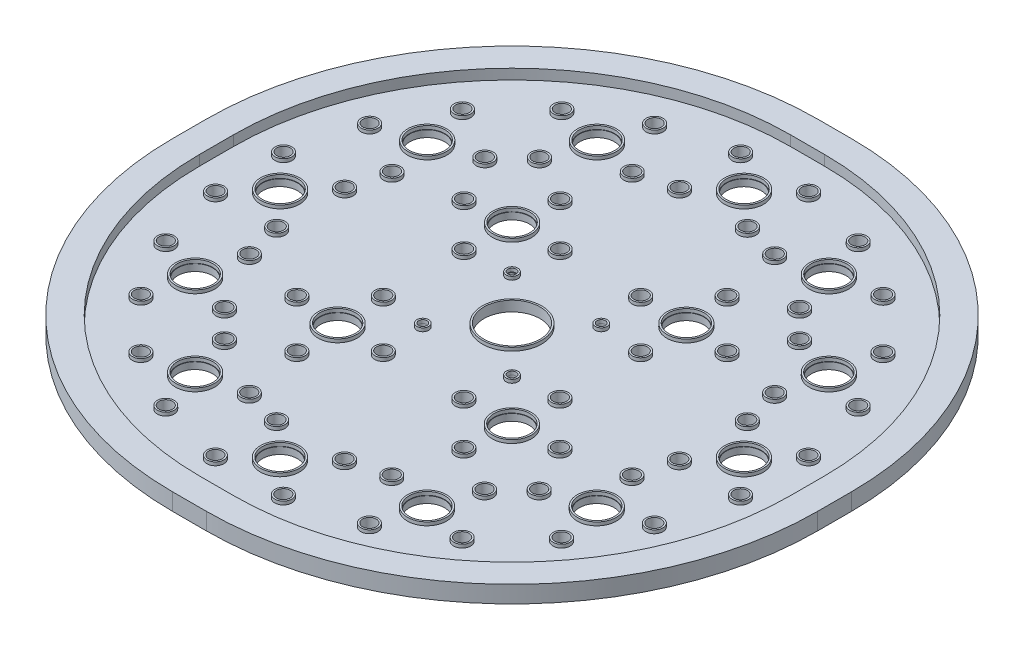
from build123d import *

# Parameters (mm, degrees)
SKETCH1_R           = 5.125
SKETCH1_R_2         = 2
SKETCH1_R_3         = 1.25
SKETCH1_R_4         = 8.25
BOSS_EXTRUDE2_DEPTH = 2
BOSS_EXTRUDE3_DEPTH = 3
SKETCH3_R           = 5.75
SKETCH3_R_2         = 5.25
SKETCH3_R_3         = 2.5
SKETCH3_R_4         = 2
SKETCH3_R_5         = 8.75
SKETCH3_R_6         = 8.25
SKETCH3_R_7         = 1.735
SKETCH3_R_8         = 1.235120991
BOSS_EXTRUDE7_DEPTH = 1


with BuildPart() as part:
    # Sketch1 → Boss-Extrude2 (new body)
    with BuildSketch(Plane(origin=(0, 0, 0), x_dir=(1, 0, 0), z_dir=(0, 1, 0))):
        with BuildLine():
            Line((-95, -5), (-95, 5))
            ThreePointArc((-95, 5), (-68.639610307, 68.639610307), (-5, 95))
            Line((-5, 95), (5, 95))
            ThreePointArc((5, 95), (68.639610307, 68.639610307), (95, 5))
            Line((95, 5), (95, -5))
            ThreePointArc((95, -5), (68.639610307, -68.639610307), (5, -95))
            Line((5, -95), (-5, -95))
            ThreePointArc((-5, -95), (-68.639610307, -68.639610307), (-95, -5))
        make_face()
        with Locations(Location((-68.3, 0.025, 0), (0, 0, 270))):
            Circle(SKETCH1_R, mode=Mode.SUBTRACT)
        with Locations(Location((-59.3, 10.028970285, 0), (0, 0, 270))):
            Circle(SKETCH1_R_2, mode=Mode.SUBTRACT)
        with Locations(Location((-59.3, -9.971029715, 0), (0, 0, 270))):
            Circle(SKETCH1_R_2, mode=Mode.SUBTRACT)
        with Locations(Location((-77.3, -9.971029715, 0), (0, 0, 270))):
            Circle(SKETCH1_R_2, mode=Mode.SUBTRACT)
        with Locations(Location((-77.3, 10.028970285, 0), (0, 0, 270))):
            Circle(SKETCH1_R_2, mode=Mode.SUBTRACT)
        with Locations(Location((-61.92927857, 47.33534304, 0), (0, 0, 270))):
            Circle(SKETCH1_R_2, mode=Mode.SUBTRACT)
        with Locations(Location((-59.137035078, 34.171650635, 0), (0, 0, 270))):
            Circle(SKETCH1_R, mode=Mode.SUBTRACT)
        with Locations(Location((-71.92927857, 30.014834965, 0), (0, 0, 270))):
            Circle(SKETCH1_R_2, mode=Mode.SUBTRACT)
        with Locations(Location((-56.340821302, 21.014834965, 0), (0, 0, 270))):
            Circle(SKETCH1_R_2, mode=Mode.SUBTRACT)
        with Locations(Location((-46.340821302, 38.33534304, 0), (0, 0, 270))):
            Circle(SKETCH1_R_2, mode=Mode.SUBTRACT)
        with Locations(Location((-29.96465696, 71.958248855, 0), (0, 0, 270))):
            Circle(SKETCH1_R_2, mode=Mode.SUBTRACT)
        with Locations(Location((-34.128349365, 59.162035078, 0), (0, 0, 270))):
            Circle(SKETCH1_R, mode=Mode.SUBTRACT)
        with Locations(Location((-47.285165035, 61.958248855, 0), (0, 0, 270))):
            Circle(SKETCH1_R_2, mode=Mode.SUBTRACT)
        with Locations(Location((-38.285165035, 46.369791587, 0), (0, 0, 270))):
            Circle(SKETCH1_R_2, mode=Mode.SUBTRACT)
        with Locations(Location((-20.96465696, 56.369791587, 0), (0, 0, 270))):
            Circle(SKETCH1_R_2, mode=Mode.SUBTRACT)
        with Locations(Location((10.028970285, 77.3, 0), (0, 0, 270))):
            Circle(SKETCH1_R_2, mode=Mode.SUBTRACT)
        with Locations(Location((0.025, 68.3, 0), (0, 0, 270))):
            Circle(SKETCH1_R, mode=Mode.SUBTRACT)
        with Locations(Location((-9.971029715, 77.3, 0), (0, 0, 270))):
            Circle(SKETCH1_R_2, mode=Mode.SUBTRACT)
        with Locations(Location((-9.971029715, 59.3, 0), (0, 0, 270))):
            Circle(SKETCH1_R_2, mode=Mode.SUBTRACT)
        with Locations(Location((10.028970285, 59.3, 0), (0, 0, 270))):
            Circle(SKETCH1_R_2, mode=Mode.SUBTRACT)
        with Locations(Location((47.33534304, 61.92927857, 0), (0, 0, 270))):
            Circle(SKETCH1_R_2, mode=Mode.SUBTRACT)
        with Locations(Location((34.171650635, 59.137035078, 0), (0, 0, 270))):
            Circle(SKETCH1_R, mode=Mode.SUBTRACT)
        with Locations(Location((30.014834965, 71.92927857, 0), (0, 0, 270))):
            Circle(SKETCH1_R_2, mode=Mode.SUBTRACT)
        with Locations(Location((21.014834965, 56.340821302, 0), (0, 0, 270))):
            Circle(SKETCH1_R_2, mode=Mode.SUBTRACT)
        with Locations(Location((38.33534304, 46.340821302, 0), (0, 0, 270))):
            Circle(SKETCH1_R_2, mode=Mode.SUBTRACT)
        with Locations(Location((71.958248855, 29.96465696, 0), (0, 0, 270))):
            Circle(SKETCH1_R_2, mode=Mode.SUBTRACT)
        with Locations(Location((59.162035078, 34.128349365, 0), (0, 0, 270))):
            Circle(SKETCH1_R, mode=Mode.SUBTRACT)
        with Locations(Location((61.958248855, 47.285165035, 0), (0, 0, 270))):
            Circle(SKETCH1_R_2, mode=Mode.SUBTRACT)
        with Locations(Location((46.369791587, 38.285165035, 0), (0, 0, 270))):
            Circle(SKETCH1_R_2, mode=Mode.SUBTRACT)
        with Locations(Location((56.369791587, 20.96465696, 0), (0, 0, 270))):
            Circle(SKETCH1_R_2, mode=Mode.SUBTRACT)
        with Locations(Location((77.3, -10.028970285, 0), (0, 0, 270))):
            Circle(SKETCH1_R_2, mode=Mode.SUBTRACT)
        with Locations(Location((68.3, -0.025, 0), (0, 0, 270))):
            Circle(SKETCH1_R, mode=Mode.SUBTRACT)
        with Locations(Location((77.3, 9.971029715, 0), (0, 0, 270))):
            Circle(SKETCH1_R_2, mode=Mode.SUBTRACT)
        with Locations(Location((59.3, 9.971029715, 0), (0, 0, 270))):
            Circle(SKETCH1_R_2, mode=Mode.SUBTRACT)
        with Locations(Location((59.3, -10.028970285, 0), (0, 0, 270))):
            Circle(SKETCH1_R_2, mode=Mode.SUBTRACT)
        with Locations(Location((61.92927857, -47.33534304, 0), (0, 0, 270))):
            Circle(SKETCH1_R_2, mode=Mode.SUBTRACT)
        with Locations(Location((59.137035078, -34.171650635, 0), (0, 0, 270))):
            Circle(SKETCH1_R, mode=Mode.SUBTRACT)
        with Locations(Location((71.92927857, -30.014834965, 0), (0, 0, 270))):
            Circle(SKETCH1_R_2, mode=Mode.SUBTRACT)
        with Locations(Location((56.340821302, -21.014834965, 0), (0, 0, 270))):
            Circle(SKETCH1_R_2, mode=Mode.SUBTRACT)
        with Locations(Location((46.340821302, -38.33534304, 0), (0, 0, 270))):
            Circle(SKETCH1_R_2, mode=Mode.SUBTRACT)
        with Locations(Location((29.96465696, -71.958248855, 0), (0, 0, 270))):
            Circle(SKETCH1_R_2, mode=Mode.SUBTRACT)
        with Locations(Location((34.128349365, -59.162035078, 0), (0, 0, 270))):
            Circle(SKETCH1_R, mode=Mode.SUBTRACT)
        with Locations(Location((47.285165035, -61.958248855, 0), (0, 0, 270))):
            Circle(SKETCH1_R_2, mode=Mode.SUBTRACT)
        with Locations(Location((38.285165035, -46.369791587, 0), (0, 0, 270))):
            Circle(SKETCH1_R_2, mode=Mode.SUBTRACT)
        with Locations(Location((20.96465696, -56.369791587, 0), (0, 0, 270))):
            Circle(SKETCH1_R_2, mode=Mode.SUBTRACT)
        with Locations(Location((-10.028970285, -77.3, 0), (0, 0, 270))):
            Circle(SKETCH1_R_2, mode=Mode.SUBTRACT)
        with Locations(Location((-0.025, -68.3, 0), (0, 0, 270))):
            Circle(SKETCH1_R, mode=Mode.SUBTRACT)
        with Locations(Location((9.971029715, -77.3, 0), (0, 0, 270))):
            Circle(SKETCH1_R_2, mode=Mode.SUBTRACT)
        with Locations(Location((9.971029715, -59.3, 0), (0, 0, 270))):
            Circle(SKETCH1_R_2, mode=Mode.SUBTRACT)
        with Locations(Location((-10.028970285, -59.3, 0), (0, 0, 270))):
            Circle(SKETCH1_R_2, mode=Mode.SUBTRACT)
        with Locations(Location((-47.33534304, -61.92927857, 0), (0, 0, 270))):
            Circle(SKETCH1_R_2, mode=Mode.SUBTRACT)
        with Locations(Location((-34.171650635, -59.137035078, 0), (0, 0, 270))):
            Circle(SKETCH1_R, mode=Mode.SUBTRACT)
        with Locations(Location((-30.014834965, -71.92927857, 0), (0, 0, 270))):
            Circle(SKETCH1_R_2, mode=Mode.SUBTRACT)
        with Locations(Location((-21.014834965, -56.340821302, 0), (0, 0, 270))):
            Circle(SKETCH1_R_2, mode=Mode.SUBTRACT)
        with Locations(Location((-38.33534304, -46.340821302, 0), (0, 0, 270))):
            Circle(SKETCH1_R_2, mode=Mode.SUBTRACT)
        with Locations(Location((-71.958248855, -29.96465696, 0), (0, 0, 270))):
            Circle(SKETCH1_R_2, mode=Mode.SUBTRACT)
        with Locations(Location((-59.162035078, -34.128349365, 0), (0, 0, 270))):
            Circle(SKETCH1_R, mode=Mode.SUBTRACT)
        with Locations(Location((-61.958248855, -47.285165035, 0), (0, 0, 270))):
            Circle(SKETCH1_R_2, mode=Mode.SUBTRACT)
        with Locations(Location((-46.369791587, -38.285165035, 0), (0, 0, 270))):
            Circle(SKETCH1_R_2, mode=Mode.SUBTRACT)
        with Locations(Location((-56.369791587, -20.96465696, 0), (0, 0, 270))):
            Circle(SKETCH1_R_2, mode=Mode.SUBTRACT)
        with Locations(Location((-13.135, -13.135, 0), (0, 0, 270))):
            Circle(SKETCH1_R_3, mode=Mode.SUBTRACT)
        with Locations(Location((13.135, -13.135, 0), (0, 0, 270))):
            Circle(SKETCH1_R_3, mode=Mode.SUBTRACT)
        with Locations(Location((13.135, 13.135, 0), (0, 0, 270))):
            Circle(SKETCH1_R_3, mode=Mode.SUBTRACT)
        with Locations(Location((-13.135, 12.8, 0), (0, 0, 270))):
            Circle(SKETCH1_R_3, mode=Mode.SUBTRACT)
        with Locations(Location((-11.858908839, 26.042014632, 0), (0, 0, 270))):
            Circle(SKETCH1_R_2, mode=Mode.SUBTRACT)
        with Locations(Location((-24.5868309, 38.769936694, 0), (0, 0, 270))):
            Circle(SKETCH1_R_2, mode=Mode.SUBTRACT)
        with Locations(Location((-38.728966524, 24.62780107, 0), (0, 0, 270))):
            Circle(SKETCH1_R_2, mode=Mode.SUBTRACT)
        with Locations(Location((-26.001044463, 11.899879009, 0), (0, 0, 270))):
            Circle(SKETCH1_R_2, mode=Mode.SUBTRACT)
        with Locations(Location((26.042014632, 11.858908839, 0), (0, 0, 270))):
            Circle(SKETCH1_R_2, mode=Mode.SUBTRACT)
        with Locations(Location((38.769936694, 24.5868309, 0), (0, 0, 270))):
            Circle(SKETCH1_R_2, mode=Mode.SUBTRACT)
        with Locations(Location((24.62780107, 38.728966524, 0), (0, 0, 270))):
            Circle(SKETCH1_R_2, mode=Mode.SUBTRACT)
        with Locations(Location((11.899879009, 26.001044463, 0), (0, 0, 270))):
            Circle(SKETCH1_R_2, mode=Mode.SUBTRACT)
        with Locations(Location((11.858908839, -26.042014632, 0), (0, 0, 270))):
            Circle(SKETCH1_R_2, mode=Mode.SUBTRACT)
        with Locations(Location((24.5868309, -38.769936694, 0), (0, 0, 270))):
            Circle(SKETCH1_R_2, mode=Mode.SUBTRACT)
        with Locations(Location((38.728966524, -24.62780107, 0), (0, 0, 270))):
            Circle(SKETCH1_R_2, mode=Mode.SUBTRACT)
        with Locations(Location((26.001044463, -11.899879009, 0), (0, 0, 270))):
            Circle(SKETCH1_R_2, mode=Mode.SUBTRACT)
        with Locations(Location((-26.042014632, -11.858908839, 0), (0, 0, 270))):
            Circle(SKETCH1_R_2, mode=Mode.SUBTRACT)
        with Locations(Location((-38.769936694, -24.5868309, 0), (0, 0, 270))):
            Circle(SKETCH1_R_2, mode=Mode.SUBTRACT)
        with Locations(Location((-24.62780107, -38.728966524, 0), (0, 0, 270))):
            Circle(SKETCH1_R_2, mode=Mode.SUBTRACT)
        with Locations(Location((-11.899879009, -26.001044463, 0), (0, 0, 270))):
            Circle(SKETCH1_R_2, mode=Mode.SUBTRACT)
        with Locations(Location((0, 0, 0), (0, 0, 270))):
            Circle(SKETCH1_R_4, mode=Mode.SUBTRACT)
        with Locations(Location((-25.685653827, -25.650298488, 0), (0, 0, 270))):
            Circle(SKETCH1_R, mode=Mode.SUBTRACT)
        with Locations(Location((-25.650298488, 25.685653827, 0), (0, 0, 270))):
            Circle(SKETCH1_R, mode=Mode.SUBTRACT)
        with Locations(Location((25.685653827, 25.650298488, 0), (0, 0, 270))):
            Circle(SKETCH1_R, mode=Mode.SUBTRACT)
        with Locations(Location((25.650298488, -25.685653827, 0), (0, 0, 270))):
            Circle(SKETCH1_R, mode=Mode.SUBTRACT)
    extrude(amount=BOSS_EXTRUDE2_DEPTH)

    # Sketch2 → Boss-Extrude3 (add)
    with BuildSketch(Plane(origin=(0, 2, 0), x_dir=(1, 0, 0), z_dir=(0, 1, 0))):
        with BuildLine():
            Line((-5, -95), (5, -95))
            ThreePointArc((5, -95), (68.639610307, -68.639610307), (95, -5))
            Line((95, -5), (95, 5))
            ThreePointArc((95, 5), (68.639610307, 68.639610307), (5, 95))
            Line((5, 95), (-5, 95))
            ThreePointArc((-5, 95), (-68.639610307, 68.639610307), (-95, 5))
            Line((-95, 5), (-95, -5))
            ThreePointArc((-95, -5), (-68.639610307, -68.639610307), (-5, -95))
        make_face()
        with BuildLine():
            ThreePointArc((-87, -5), (-62.982756057, -62.982756057), (-5, -87))
            Line((-5, -87), (5, -87))
            ThreePointArc((5, -87), (62.982756057, -62.982756057), (87, -5))
            Line((87, -5), (87, 5))
            ThreePointArc((87, 5), (62.982756057, 62.982756057), (5, 87))
            Line((5, 87), (-5, 87))
            ThreePointArc((-5, 87), (-62.982756057, 62.982756057), (-87, 5))
            Line((-87, 5), (-87, -5))
        make_face(mode=Mode.SUBTRACT)
    extrude(amount=BOSS_EXTRUDE3_DEPTH)

    # Sketch3 → Boss-Extrude7 (add)
    # profile 1 of 85: a face of its own
    with BuildSketch(Plane(origin=(0, 2, 0), x_dir=(1, 0, 0), z_dir=(0, 1, 0))):
        with Locations(Location((-59.162035078, -34.128349365, 0), (0, 0, 90))):
            Circle(SKETCH3_R)
        with Locations(Location((-59.162035078, -34.128349365, 0), (0, 0, 270))):
            Circle(SKETCH3_R_2, mode=Mode.SUBTRACT)
    # profile 2 of 85: a face of its own
    with BuildSketch(Plane(origin=(0, 2, 0), x_dir=(1, 0, 0), z_dir=(0, 1, 0))):
        with Locations(Location((-68.3, 0.025, 0), (0, 0, 90))):
            Circle(SKETCH3_R)
        with Locations(Location((-68.3, 0.025, 0), (0, 0, 270))):
            Circle(SKETCH3_R_2, mode=Mode.SUBTRACT)
    # profile 3 of 85: a face of its own
    with BuildSketch(Plane(origin=(0, 2, 0), x_dir=(1, 0, 0), z_dir=(0, 1, 0))):
        with Locations(Location((-59.137035078, 34.171650635, 0), (0, 0, 90))):
            Circle(SKETCH3_R)
        with Locations(Location((-59.137035078, 34.171650635, 0), (0, 0, 270))):
            Circle(SKETCH3_R_2, mode=Mode.SUBTRACT)
    # profile 4 of 85: a face of its own
    with BuildSketch(Plane(origin=(0, 2, 0), x_dir=(1, 0, 0), z_dir=(0, 1, 0))):
        with Locations(Location((-34.128349365, 59.162035078, 0), (0, 0, 90))):
            Circle(SKETCH3_R)
        with Locations(Location((-34.128349365, 59.162035078, 0), (0, 0, 270))):
            Circle(SKETCH3_R_2, mode=Mode.SUBTRACT)
    # profile 5 of 85: a face of its own
    with BuildSketch(Plane(origin=(0, 2, 0), x_dir=(1, 0, 0), z_dir=(0, 1, 0))):
        with Locations(Location((0.025, 68.3, 0), (0, 0, 90))):
            Circle(SKETCH3_R)
        with Locations(Location((0.025, 68.3, 0), (0, 0, 270))):
            Circle(SKETCH3_R_2, mode=Mode.SUBTRACT)
    # profile 6 of 85: a face of its own
    with BuildSketch(Plane(origin=(0, 2, 0), x_dir=(1, 0, 0), z_dir=(0, 1, 0))):
        with Locations(Location((34.171650635, 59.137035078, 0), (0, 0, 90))):
            Circle(SKETCH3_R)
        with Locations(Location((34.171650635, 59.137035078, 0), (0, 0, 270))):
            Circle(SKETCH3_R_2, mode=Mode.SUBTRACT)
    # profile 7 of 85: a face of its own
    with BuildSketch(Plane(origin=(0, 2, 0), x_dir=(1, 0, 0), z_dir=(0, 1, 0))):
        with Locations(Location((59.162035078, 34.128349365, 0), (0, 0, 90))):
            Circle(SKETCH3_R)
        with Locations(Location((59.162035078, 34.128349365, 0), (0, 0, 270))):
            Circle(SKETCH3_R_2, mode=Mode.SUBTRACT)
    # profile 8 of 85: a face of its own
    with BuildSketch(Plane(origin=(0, 2, 0), x_dir=(1, 0, 0), z_dir=(0, 1, 0))):
        with Locations(Location((68.3, -0.025, 0), (0, 0, 90))):
            Circle(SKETCH3_R)
        with Locations(Location((68.3, -0.025, 0), (0, 0, 270))):
            Circle(SKETCH3_R_2, mode=Mode.SUBTRACT)
    # profile 9 of 85: a face of its own
    with BuildSketch(Plane(origin=(0, 2, 0), x_dir=(1, 0, 0), z_dir=(0, 1, 0))):
        with Locations(Location((59.137035078, -34.171650635, 0), (0, 0, 90))):
            Circle(SKETCH3_R)
        with Locations(Location((59.137035078, -34.171650635, 0), (0, 0, 270))):
            Circle(SKETCH3_R_2, mode=Mode.SUBTRACT)
    # profile 10 of 85: a face of its own
    with BuildSketch(Plane(origin=(0, 2, 0), x_dir=(1, 0, 0), z_dir=(0, 1, 0))):
        with Locations(Location((34.128349365, -59.162035078, 0), (0, 0, 90))):
            Circle(SKETCH3_R)
        with Locations(Location((34.128349365, -59.162035078, 0), (0, 0, 270))):
            Circle(SKETCH3_R_2, mode=Mode.SUBTRACT)
    # profile 11 of 85: a face of its own
    with BuildSketch(Plane(origin=(0, 2, 0), x_dir=(1, 0, 0), z_dir=(0, 1, 0))):
        with Locations(Location((-0.025, -68.3, 0), (0, 0, 90))):
            Circle(SKETCH3_R)
        with Locations(Location((-0.025, -68.3, 0), (0, 0, 270))):
            Circle(SKETCH3_R_2, mode=Mode.SUBTRACT)
    # profile 12 of 85: a face of its own
    with BuildSketch(Plane(origin=(0, 2, 0), x_dir=(1, 0, 0), z_dir=(0, 1, 0))):
        with Locations(Location((-34.171650635, -59.137035078, 0), (0, 0, 90))):
            Circle(SKETCH3_R)
        with Locations(Location((-34.171650635, -59.137035078, 0), (0, 0, 270))):
            Circle(SKETCH3_R_2, mode=Mode.SUBTRACT)
    # profile 13 of 85: a face of its own
    with BuildSketch(Plane(origin=(0, 2, 0), x_dir=(1, 0, 0), z_dir=(0, 1, 0))):
        with Locations(Location((-25.685653827, -25.650298488, 0), (0, 0, 90))):
            Circle(SKETCH3_R)
        with Locations(Location((-25.685653827, -25.650298488, 0), (0, 0, 270))):
            Circle(SKETCH3_R_2, mode=Mode.SUBTRACT)
    # profile 14 of 85: a face of its own
    with BuildSketch(Plane(origin=(0, 2, 0), x_dir=(1, 0, 0), z_dir=(0, 1, 0))):
        with Locations(Location((-25.650298488, 25.685653827, 0), (0, 0, 90))):
            Circle(SKETCH3_R)
        with Locations(Location((-25.650298488, 25.685653827, 0), (0, 0, 270))):
            Circle(SKETCH3_R_2, mode=Mode.SUBTRACT)
    # profile 15 of 85: a face of its own
    with BuildSketch(Plane(origin=(0, 2, 0), x_dir=(1, 0, 0), z_dir=(0, 1, 0))):
        with Locations(Location((25.685653827, 25.650298488, 0), (0, 0, 90))):
            Circle(SKETCH3_R)
        with Locations(Location((25.685653827, 25.650298488, 0), (0, 0, 270))):
            Circle(SKETCH3_R_2, mode=Mode.SUBTRACT)
    # profile 16 of 85: a face of its own
    with BuildSketch(Plane(origin=(0, 2, 0), x_dir=(1, 0, 0), z_dir=(0, 1, 0))):
        with Locations(Location((25.650298488, -25.685653827, 0), (0, 0, 90))):
            Circle(SKETCH3_R)
        with Locations(Location((25.650298488, -25.685653827, 0), (0, 0, 270))):
            Circle(SKETCH3_R_2, mode=Mode.SUBTRACT)
    # profile 17 of 85: a face of its own
    with BuildSketch(Plane(origin=(0, 2, 0), x_dir=(1, 0, 0), z_dir=(0, 1, 0))):
        with Locations(Location((-56.369791587, -20.96465696, 0), (0, 0, 90))):
            Circle(SKETCH3_R_3)
        with Locations(Location((-56.369791587, -20.96465696, 0), (0, 0, 270))):
            Circle(SKETCH3_R_4, mode=Mode.SUBTRACT)
    # profile 18 of 85: a face of its own
    with BuildSketch(Plane(origin=(0, 2, 0), x_dir=(1, 0, 0), z_dir=(0, 1, 0))):
        with Locations(Location((0, 0, 0), (0, 0, 90))):
            Circle(SKETCH3_R_5)
        with Locations(Location((0, 0, 0), (0, 0, 270))):
            Circle(SKETCH3_R_6, mode=Mode.SUBTRACT)
    # profile 19 of 85: a face of its own
    with BuildSketch(Plane(origin=(0, 2, 0), x_dir=(1, 0, 0), z_dir=(0, 1, 0))):
        with Locations(Location((-46.369791587, -38.285165035, 0), (0, 0, 90))):
            Circle(SKETCH3_R_3)
        with Locations(Location((-46.369791587, -38.285165035, 0), (0, 0, 270))):
            Circle(SKETCH3_R_4, mode=Mode.SUBTRACT)
    # profile 20 of 85: a face of its own
    with BuildSketch(Plane(origin=(0, 2, 0), x_dir=(1, 0, 0), z_dir=(0, 1, 0))):
        with Locations(Location((-71.958248855, -29.96465696, 0), (0, 0, 90))):
            Circle(SKETCH3_R_3)
        with Locations(Location((-71.958248855, -29.96465696, 0), (0, 0, 270))):
            Circle(SKETCH3_R_4, mode=Mode.SUBTRACT)
    # profile 21 of 85: a face of its own
    with BuildSketch(Plane(origin=(0, 2, 0), x_dir=(1, 0, 0), z_dir=(0, 1, 0))):
        with Locations(Location((-61.958248855, -47.285165035, 0), (0, 0, 90))):
            Circle(SKETCH3_R_3)
        with Locations(Location((-61.958248855, -47.285165035, 0), (0, 0, 270))):
            Circle(SKETCH3_R_4, mode=Mode.SUBTRACT)
    # profile 22 of 85: a face of its own
    with BuildSketch(Plane(origin=(0, 2, 0), x_dir=(1, 0, 0), z_dir=(0, 1, 0))):
        with Locations(Location((-77.3, -9.971029715, 0), (0, 0, 90))):
            Circle(SKETCH3_R_3)
        with Locations(Location((-77.3, -9.971029715, 0), (0, 0, 270))):
            Circle(SKETCH3_R_4, mode=Mode.SUBTRACT)
    # profile 23 of 85: a face of its own
    with BuildSketch(Plane(origin=(0, 2, 0), x_dir=(1, 0, 0), z_dir=(0, 1, 0))):
        with Locations(Location((-59.3, -9.971029715, 0), (0, 0, 90))):
            Circle(SKETCH3_R_3)
        with Locations(Location((-59.3, -9.971029715, 0), (0, 0, 270))):
            Circle(SKETCH3_R_4, mode=Mode.SUBTRACT)
    # profile 24 of 85: a face of its own
    with BuildSketch(Plane(origin=(0, 2, 0), x_dir=(1, 0, 0), z_dir=(0, 1, 0))):
        with Locations(Location((-59.3, 10.028970285, 0), (0, 0, 90))):
            Circle(SKETCH3_R_3)
        with Locations(Location((-59.3, 10.028970285, 0), (0, 0, 270))):
            Circle(SKETCH3_R_4, mode=Mode.SUBTRACT)
    # profile 25 of 85: a face of its own
    with BuildSketch(Plane(origin=(0, 2, 0), x_dir=(1, 0, 0), z_dir=(0, 1, 0))):
        with Locations(Location((-77.3, 10.028970285, 0), (0, 0, 90))):
            Circle(SKETCH3_R_3)
        with Locations(Location((-77.3, 10.028970285, 0), (0, 0, 270))):
            Circle(SKETCH3_R_4, mode=Mode.SUBTRACT)
    # profile 26 of 85: a face of its own
    with BuildSketch(Plane(origin=(0, 2, 0), x_dir=(1, 0, 0), z_dir=(0, 1, 0))):
        with Locations(Location((-71.92927857, 30.014834965, 0), (0, 0, 90))):
            Circle(SKETCH3_R_3)
        with Locations(Location((-71.92927857, 30.014834965, 0), (0, 0, 270))):
            Circle(SKETCH3_R_4, mode=Mode.SUBTRACT)
    # profile 27 of 85: a face of its own
    with BuildSketch(Plane(origin=(0, 2, 0), x_dir=(1, 0, 0), z_dir=(0, 1, 0))):
        with Locations(Location((-56.340821302, 21.014834965, 0), (0, 0, 90))):
            Circle(SKETCH3_R_3)
        with Locations(Location((-56.340821302, 21.014834965, 0), (0, 0, 270))):
            Circle(SKETCH3_R_4, mode=Mode.SUBTRACT)
    # profile 28 of 85: a face of its own
    with BuildSketch(Plane(origin=(0, 2, 0), x_dir=(1, 0, 0), z_dir=(0, 1, 0))):
        with Locations(Location((-46.340821302, 38.33534304, 0), (0, 0, 90))):
            Circle(SKETCH3_R_3)
        with Locations(Location((-46.340821302, 38.33534304, 0), (0, 0, 270))):
            Circle(SKETCH3_R_4, mode=Mode.SUBTRACT)
    # profile 29 of 85: a face of its own
    with BuildSketch(Plane(origin=(0, 2, 0), x_dir=(1, 0, 0), z_dir=(0, 1, 0))):
        with Locations(Location((-61.92927857, 47.33534304, 0), (0, 0, 90))):
            Circle(SKETCH3_R_3)
        with Locations(Location((-61.92927857, 47.33534304, 0), (0, 0, 270))):
            Circle(SKETCH3_R_4, mode=Mode.SUBTRACT)
    # profile 30 of 85: a face of its own
    with BuildSketch(Plane(origin=(0, 2, 0), x_dir=(1, 0, 0), z_dir=(0, 1, 0))):
        with Locations(Location((-47.285165035, 61.958248855, 0), (0, 0, 90))):
            Circle(SKETCH3_R_3)
        with Locations(Location((-47.285165035, 61.958248855, 0), (0, 0, 270))):
            Circle(SKETCH3_R_4, mode=Mode.SUBTRACT)
    # profile 31 of 85: a face of its own
    with BuildSketch(Plane(origin=(0, 2, 0), x_dir=(1, 0, 0), z_dir=(0, 1, 0))):
        with Locations(Location((-38.285165035, 46.369791587, 0), (0, 0, 90))):
            Circle(SKETCH3_R_3)
        with Locations(Location((-38.285165035, 46.369791587, 0), (0, 0, 270))):
            Circle(SKETCH3_R_4, mode=Mode.SUBTRACT)
    # profile 32 of 85: a face of its own
    with BuildSketch(Plane(origin=(0, 2, 0), x_dir=(1, 0, 0), z_dir=(0, 1, 0))):
        with Locations(Location((-20.96465696, 56.369791587, 0), (0, 0, 90))):
            Circle(SKETCH3_R_3)
        with Locations(Location((-20.96465696, 56.369791587, 0), (0, 0, 270))):
            Circle(SKETCH3_R_4, mode=Mode.SUBTRACT)
    # profile 33 of 85: a face of its own
    with BuildSketch(Plane(origin=(0, 2, 0), x_dir=(1, 0, 0), z_dir=(0, 1, 0))):
        with Locations(Location((-29.96465696, 71.958248855, 0), (0, 0, 90))):
            Circle(SKETCH3_R_3)
        with Locations(Location((-29.96465696, 71.958248855, 0), (0, 0, 270))):
            Circle(SKETCH3_R_4, mode=Mode.SUBTRACT)
    # profile 34 of 85: a face of its own
    with BuildSketch(Plane(origin=(0, 2, 0), x_dir=(1, 0, 0), z_dir=(0, 1, 0))):
        with Locations(Location((-9.971029715, 77.3, 0), (0, 0, 90))):
            Circle(SKETCH3_R_3)
        with Locations(Location((-9.971029715, 77.3, 0), (0, 0, 270))):
            Circle(SKETCH3_R_4, mode=Mode.SUBTRACT)
    # profile 35 of 85: a face of its own
    with BuildSketch(Plane(origin=(0, 2, 0), x_dir=(1, 0, 0), z_dir=(0, 1, 0))):
        with Locations(Location((-9.971029715, 59.3, 0), (0, 0, 90))):
            Circle(SKETCH3_R_3)
        with Locations(Location((-9.971029715, 59.3, 0), (0, 0, 270))):
            Circle(SKETCH3_R_4, mode=Mode.SUBTRACT)
    # profile 36 of 85: a face of its own
    with BuildSketch(Plane(origin=(0, 2, 0), x_dir=(1, 0, 0), z_dir=(0, 1, 0))):
        with Locations(Location((10.028970285, 59.3, 0), (0, 0, 90))):
            Circle(SKETCH3_R_3)
        with Locations(Location((10.028970285, 59.3, 0), (0, 0, 270))):
            Circle(SKETCH3_R_4, mode=Mode.SUBTRACT)
    # profile 37 of 85: a face of its own
    with BuildSketch(Plane(origin=(0, 2, 0), x_dir=(1, 0, 0), z_dir=(0, 1, 0))):
        with Locations(Location((10.028970285, 77.3, 0), (0, 0, 90))):
            Circle(SKETCH3_R_3)
        with Locations(Location((10.028970285, 77.3, 0), (0, 0, 270))):
            Circle(SKETCH3_R_4, mode=Mode.SUBTRACT)
    # profile 38 of 85: a face of its own
    with BuildSketch(Plane(origin=(0, 2, 0), x_dir=(1, 0, 0), z_dir=(0, 1, 0))):
        with Locations(Location((30.014834965, 71.92927857, 0), (0, 0, 90))):
            Circle(SKETCH3_R_3)
        with Locations(Location((30.014834965, 71.92927857, 0), (0, 0, 270))):
            Circle(SKETCH3_R_4, mode=Mode.SUBTRACT)
    # profile 39 of 85: a face of its own
    with BuildSketch(Plane(origin=(0, 2, 0), x_dir=(1, 0, 0), z_dir=(0, 1, 0))):
        with Locations(Location((21.014834965, 56.340821302, 0), (0, 0, 90))):
            Circle(SKETCH3_R_3)
        with Locations(Location((21.014834965, 56.340821302, 0), (0, 0, 270))):
            Circle(SKETCH3_R_4, mode=Mode.SUBTRACT)
    # profile 40 of 85: a face of its own
    with BuildSketch(Plane(origin=(0, 2, 0), x_dir=(1, 0, 0), z_dir=(0, 1, 0))):
        with Locations(Location((38.33534304, 46.340821302, 0), (0, 0, 90))):
            Circle(SKETCH3_R_3)
        with Locations(Location((38.33534304, 46.340821302, 0), (0, 0, 270))):
            Circle(SKETCH3_R_4, mode=Mode.SUBTRACT)
    # profile 41 of 85: a face of its own
    with BuildSketch(Plane(origin=(0, 2, 0), x_dir=(1, 0, 0), z_dir=(0, 1, 0))):
        with Locations(Location((47.33534304, 61.92927857, 0), (0, 0, 90))):
            Circle(SKETCH3_R_3)
        with Locations(Location((47.33534304, 61.92927857, 0), (0, 0, 270))):
            Circle(SKETCH3_R_4, mode=Mode.SUBTRACT)
    # profile 42 of 85: a face of its own
    with BuildSketch(Plane(origin=(0, 2, 0), x_dir=(1, 0, 0), z_dir=(0, 1, 0))):
        with Locations(Location((61.958248855, 47.285165035, 0), (0, 0, 90))):
            Circle(SKETCH3_R_3)
        with Locations(Location((61.958248855, 47.285165035, 0), (0, 0, 270))):
            Circle(SKETCH3_R_4, mode=Mode.SUBTRACT)
    # profile 43 of 85: a face of its own
    with BuildSketch(Plane(origin=(0, 2, 0), x_dir=(1, 0, 0), z_dir=(0, 1, 0))):
        with Locations(Location((46.369791587, 38.285165035, 0), (0, 0, 90))):
            Circle(SKETCH3_R_3)
        with Locations(Location((46.369791587, 38.285165035, 0), (0, 0, 270))):
            Circle(SKETCH3_R_4, mode=Mode.SUBTRACT)
    # profile 44 of 85: a face of its own
    with BuildSketch(Plane(origin=(0, 2, 0), x_dir=(1, 0, 0), z_dir=(0, 1, 0))):
        with Locations(Location((56.369791587, 20.96465696, 0), (0, 0, 90))):
            Circle(SKETCH3_R_3)
        with Locations(Location((56.369791587, 20.96465696, 0), (0, 0, 270))):
            Circle(SKETCH3_R_4, mode=Mode.SUBTRACT)
    # profile 45 of 85: a face of its own
    with BuildSketch(Plane(origin=(0, 2, 0), x_dir=(1, 0, 0), z_dir=(0, 1, 0))):
        with Locations(Location((71.958248855, 29.96465696, 0), (0, 0, 90))):
            Circle(SKETCH3_R_3)
        with Locations(Location((71.958248855, 29.96465696, 0), (0, 0, 270))):
            Circle(SKETCH3_R_4, mode=Mode.SUBTRACT)
    # profile 46 of 85: a face of its own
    with BuildSketch(Plane(origin=(0, 2, 0), x_dir=(1, 0, 0), z_dir=(0, 1, 0))):
        with Locations(Location((77.3, 9.971029715, 0), (0, 0, 90))):
            Circle(SKETCH3_R_3)
        with Locations(Location((77.3, 9.971029715, 0), (0, 0, 270))):
            Circle(SKETCH3_R_4, mode=Mode.SUBTRACT)
    # profile 47 of 85: a face of its own
    with BuildSketch(Plane(origin=(0, 2, 0), x_dir=(1, 0, 0), z_dir=(0, 1, 0))):
        with Locations(Location((59.3, 9.971029715, 0), (0, 0, 90))):
            Circle(SKETCH3_R_3)
        with Locations(Location((59.3, 9.971029715, 0), (0, 0, 270))):
            Circle(SKETCH3_R_4, mode=Mode.SUBTRACT)
    # profile 48 of 85: a face of its own
    with BuildSketch(Plane(origin=(0, 2, 0), x_dir=(1, 0, 0), z_dir=(0, 1, 0))):
        with Locations(Location((59.3, -10.028970285, 0), (0, 0, 90))):
            Circle(SKETCH3_R_3)
        with Locations(Location((59.3, -10.028970285, 0), (0, 0, 270))):
            Circle(SKETCH3_R_4, mode=Mode.SUBTRACT)
    # profile 49 of 85: a face of its own
    with BuildSketch(Plane(origin=(0, 2, 0), x_dir=(1, 0, 0), z_dir=(0, 1, 0))):
        with Locations(Location((77.3, -10.028970285, 0), (0, 0, 90))):
            Circle(SKETCH3_R_3)
        with Locations(Location((77.3, -10.028970285, 0), (0, 0, 270))):
            Circle(SKETCH3_R_4, mode=Mode.SUBTRACT)
    # profile 50 of 85: a face of its own
    with BuildSketch(Plane(origin=(0, 2, 0), x_dir=(1, 0, 0), z_dir=(0, 1, 0))):
        with Locations(Location((71.92927857, -30.014834965, 0), (0, 0, 90))):
            Circle(SKETCH3_R_3)
        with Locations(Location((71.92927857, -30.014834965, 0), (0, 0, 270))):
            Circle(SKETCH3_R_4, mode=Mode.SUBTRACT)
    # profile 51 of 85: a face of its own
    with BuildSketch(Plane(origin=(0, 2, 0), x_dir=(1, 0, 0), z_dir=(0, 1, 0))):
        with Locations(Location((56.340821302, -21.014834965, 0), (0, 0, 90))):
            Circle(SKETCH3_R_3)
        with Locations(Location((56.340821302, -21.014834965, 0), (0, 0, 270))):
            Circle(SKETCH3_R_4, mode=Mode.SUBTRACT)
    # profile 52 of 85: a face of its own
    with BuildSketch(Plane(origin=(0, 2, 0), x_dir=(1, 0, 0), z_dir=(0, 1, 0))):
        with Locations(Location((46.340821302, -38.33534304, 0), (0, 0, 90))):
            Circle(SKETCH3_R_3)
        with Locations(Location((46.340821302, -38.33534304, 0), (0, 0, 270))):
            Circle(SKETCH3_R_4, mode=Mode.SUBTRACT)
    # profile 53 of 85: a face of its own
    with BuildSketch(Plane(origin=(0, 2, 0), x_dir=(1, 0, 0), z_dir=(0, 1, 0))):
        with Locations(Location((61.92927857, -47.33534304, 0), (0, 0, 90))):
            Circle(SKETCH3_R_3)
        with Locations(Location((61.92927857, -47.33534304, 0), (0, 0, 270))):
            Circle(SKETCH3_R_4, mode=Mode.SUBTRACT)
    # profile 54 of 85: a face of its own
    with BuildSketch(Plane(origin=(0, 2, 0), x_dir=(1, 0, 0), z_dir=(0, 1, 0))):
        with Locations(Location((47.285165035, -61.958248855, 0), (0, 0, 90))):
            Circle(SKETCH3_R_3)
        with Locations(Location((47.285165035, -61.958248855, 0), (0, 0, 270))):
            Circle(SKETCH3_R_4, mode=Mode.SUBTRACT)
    # profile 55 of 85: a face of its own
    with BuildSketch(Plane(origin=(0, 2, 0), x_dir=(1, 0, 0), z_dir=(0, 1, 0))):
        with Locations(Location((38.285165035, -46.369791587, 0), (0, 0, 90))):
            Circle(SKETCH3_R_3)
        with Locations(Location((38.285165035, -46.369791587, 0), (0, 0, 270))):
            Circle(SKETCH3_R_4, mode=Mode.SUBTRACT)
    # profile 56 of 85: a face of its own
    with BuildSketch(Plane(origin=(0, 2, 0), x_dir=(1, 0, 0), z_dir=(0, 1, 0))):
        with Locations(Location((20.96465696, -56.369791587, 0), (0, 0, 90))):
            Circle(SKETCH3_R_3)
        with Locations(Location((20.96465696, -56.369791587, 0), (0, 0, 270))):
            Circle(SKETCH3_R_4, mode=Mode.SUBTRACT)
    # profile 57 of 85: a face of its own
    with BuildSketch(Plane(origin=(0, 2, 0), x_dir=(1, 0, 0), z_dir=(0, 1, 0))):
        with Locations(Location((29.96465696, -71.958248855, 0), (0, 0, 90))):
            Circle(SKETCH3_R_3)
        with Locations(Location((29.96465696, -71.958248855, 0), (0, 0, 270))):
            Circle(SKETCH3_R_4, mode=Mode.SUBTRACT)
    # profile 58 of 85: a face of its own
    with BuildSketch(Plane(origin=(0, 2, 0), x_dir=(1, 0, 0), z_dir=(0, 1, 0))):
        with Locations(Location((9.971029715, -77.3, 0), (0, 0, 90))):
            Circle(SKETCH3_R_3)
        with Locations(Location((9.971029715, -77.3, 0), (0, 0, 270))):
            Circle(SKETCH3_R_4, mode=Mode.SUBTRACT)
    # profile 59 of 85: a face of its own
    with BuildSketch(Plane(origin=(0, 2, 0), x_dir=(1, 0, 0), z_dir=(0, 1, 0))):
        with Locations(Location((9.971029715, -59.3, 0), (0, 0, 90))):
            Circle(SKETCH3_R_3)
        with Locations(Location((9.971029715, -59.3, 0), (0, 0, 270))):
            Circle(SKETCH3_R_4, mode=Mode.SUBTRACT)
    # profile 60 of 85: a face of its own
    with BuildSketch(Plane(origin=(0, 2, 0), x_dir=(1, 0, 0), z_dir=(0, 1, 0))):
        with Locations(Location((-10.028970285, -59.3, 0), (0, 0, 90))):
            Circle(SKETCH3_R_3)
        with Locations(Location((-10.028970285, -59.3, 0), (0, 0, 270))):
            Circle(SKETCH3_R_4, mode=Mode.SUBTRACT)
    # profile 61 of 85: a face of its own
    with BuildSketch(Plane(origin=(0, 2, 0), x_dir=(1, 0, 0), z_dir=(0, 1, 0))):
        with Locations(Location((-10.028970285, -77.3, 0), (0, 0, 90))):
            Circle(SKETCH3_R_3)
        with Locations(Location((-10.028970285, -77.3, 0), (0, 0, 270))):
            Circle(SKETCH3_R_4, mode=Mode.SUBTRACT)
    # profile 62 of 85: a face of its own
    with BuildSketch(Plane(origin=(0, 2, 0), x_dir=(1, 0, 0), z_dir=(0, 1, 0))):
        with Locations(Location((-30.014834965, -71.92927857, 0), (0, 0, 90))):
            Circle(SKETCH3_R_3)
        with Locations(Location((-30.014834965, -71.92927857, 0), (0, 0, 270))):
            Circle(SKETCH3_R_4, mode=Mode.SUBTRACT)
    # profile 63 of 85: a face of its own
    with BuildSketch(Plane(origin=(0, 2, 0), x_dir=(1, 0, 0), z_dir=(0, 1, 0))):
        with Locations(Location((-21.014834965, -56.340821302, 0), (0, 0, 90))):
            Circle(SKETCH3_R_3)
        with Locations(Location((-21.014834965, -56.340821302, 0), (0, 0, 270))):
            Circle(SKETCH3_R_4, mode=Mode.SUBTRACT)
    # profile 64 of 85: a face of its own
    with BuildSketch(Plane(origin=(0, 2, 0), x_dir=(1, 0, 0), z_dir=(0, 1, 0))):
        with Locations(Location((-38.33534304, -46.340821302, 0), (0, 0, 90))):
            Circle(SKETCH3_R_3)
        with Locations(Location((-38.33534304, -46.340821302, 0), (0, 0, 270))):
            Circle(SKETCH3_R_4, mode=Mode.SUBTRACT)
    # profile 65 of 85: a face of its own
    with BuildSketch(Plane(origin=(0, 2, 0), x_dir=(1, 0, 0), z_dir=(0, 1, 0))):
        with Locations(Location((-47.33534304, -61.92927857, 0), (0, 0, 90))):
            Circle(SKETCH3_R_3)
        with Locations(Location((-47.33534304, -61.92927857, 0), (0, 0, 270))):
            Circle(SKETCH3_R_4, mode=Mode.SUBTRACT)
    # profile 66 of 85: a face of its own
    with BuildSketch(Plane(origin=(0, 2, 0), x_dir=(1, 0, 0), z_dir=(0, 1, 0))):
        with Locations(Location((-38.769936694, -24.5868309, 0), (0, 0, 90))):
            Circle(SKETCH3_R_3)
        with Locations(Location((-38.769936694, -24.5868309, 0), (0, 0, 270))):
            Circle(SKETCH3_R_4, mode=Mode.SUBTRACT)
    # profile 67 of 85: a face of its own
    with BuildSketch(Plane(origin=(0, 2, 0), x_dir=(1, 0, 0), z_dir=(0, 1, 0))):
        with Locations(Location((-26.042014632, -11.858908839, 0), (0, 0, 90))):
            Circle(SKETCH3_R_3)
        with Locations(Location((-26.042014632, -11.858908839, 0), (0, 0, 270))):
            Circle(SKETCH3_R_4, mode=Mode.SUBTRACT)
    # profile 68 of 85: a face of its own
    with BuildSketch(Plane(origin=(0, 2, 0), x_dir=(1, 0, 0), z_dir=(0, 1, 0))):
        with Locations(Location((-24.62780107, -38.728966524, 0), (0, 0, 90))):
            Circle(SKETCH3_R_3)
        with Locations(Location((-24.62780107, -38.728966524, 0), (0, 0, 270))):
            Circle(SKETCH3_R_4, mode=Mode.SUBTRACT)
    # profile 69 of 85: a face of its own
    with BuildSketch(Plane(origin=(0, 2, 0), x_dir=(1, 0, 0), z_dir=(0, 1, 0))):
        with Locations(Location((-11.899879009, -26.001044463, 0), (0, 0, 90))):
            Circle(SKETCH3_R_3)
        with Locations(Location((-11.899879009, -26.001044463, 0), (0, 0, 270))):
            Circle(SKETCH3_R_4, mode=Mode.SUBTRACT)
    # profile 70 of 85: a face of its own
    with BuildSketch(Plane(origin=(0, 2, 0), x_dir=(1, 0, 0), z_dir=(0, 1, 0))):
        with Locations(Location((-24.5868309, 38.769936694, 0), (0, 0, 90))):
            Circle(SKETCH3_R_3)
        with Locations(Location((-24.5868309, 38.769936694, 0), (0, 0, 270))):
            Circle(SKETCH3_R_4, mode=Mode.SUBTRACT)
    # profile 71 of 85: a face of its own
    with BuildSketch(Plane(origin=(0, 2, 0), x_dir=(1, 0, 0), z_dir=(0, 1, 0))):
        with Locations(Location((-11.858908839, 26.042014632, 0), (0, 0, 90))):
            Circle(SKETCH3_R_3)
        with Locations(Location((-11.858908839, 26.042014632, 0), (0, 0, 270))):
            Circle(SKETCH3_R_4, mode=Mode.SUBTRACT)
    # profile 72 of 85: a face of its own
    with BuildSketch(Plane(origin=(0, 2, 0), x_dir=(1, 0, 0), z_dir=(0, 1, 0))):
        with Locations(Location((-26.001044463, 11.899879009, 0), (0, 0, 90))):
            Circle(SKETCH3_R_3)
        with Locations(Location((-26.001044463, 11.899879009, 0), (0, 0, 270))):
            Circle(SKETCH3_R_4, mode=Mode.SUBTRACT)
    # profile 73 of 85: a face of its own
    with BuildSketch(Plane(origin=(0, 2, 0), x_dir=(1, 0, 0), z_dir=(0, 1, 0))):
        with Locations(Location((-38.728966524, 24.62780107, 0), (0, 0, 90))):
            Circle(SKETCH3_R_3)
        with Locations(Location((-38.728966524, 24.62780107, 0), (0, 0, 270))):
            Circle(SKETCH3_R_4, mode=Mode.SUBTRACT)
    # profile 74 of 85: a face of its own
    with BuildSketch(Plane(origin=(0, 2, 0), x_dir=(1, 0, 0), z_dir=(0, 1, 0))):
        with Locations(Location((38.769936694, 24.5868309, 0), (0, 0, 90))):
            Circle(SKETCH3_R_3)
        with Locations(Location((38.769936694, 24.5868309, 0), (0, 0, 270))):
            Circle(SKETCH3_R_4, mode=Mode.SUBTRACT)
    # profile 75 of 85: a face of its own
    with BuildSketch(Plane(origin=(0, 2, 0), x_dir=(1, 0, 0), z_dir=(0, 1, 0))):
        with Locations(Location((26.042014632, 11.858908839, 0), (0, 0, 90))):
            Circle(SKETCH3_R_3)
        with Locations(Location((26.042014632, 11.858908839, 0), (0, 0, 270))):
            Circle(SKETCH3_R_4, mode=Mode.SUBTRACT)
    # profile 76 of 85: a face of its own
    with BuildSketch(Plane(origin=(0, 2, 0), x_dir=(1, 0, 0), z_dir=(0, 1, 0))):
        with Locations(Location((11.899879009, 26.001044463, 0), (0, 0, 90))):
            Circle(SKETCH3_R_3)
        with Locations(Location((11.899879009, 26.001044463, 0), (0, 0, 270))):
            Circle(SKETCH3_R_4, mode=Mode.SUBTRACT)
    # profile 77 of 85: a face of its own
    with BuildSketch(Plane(origin=(0, 2, 0), x_dir=(1, 0, 0), z_dir=(0, 1, 0))):
        with Locations(Location((24.62780107, 38.728966524, 0), (0, 0, 90))):
            Circle(SKETCH3_R_3)
        with Locations(Location((24.62780107, 38.728966524, 0), (0, 0, 270))):
            Circle(SKETCH3_R_4, mode=Mode.SUBTRACT)
    # profile 78 of 85: a face of its own
    with BuildSketch(Plane(origin=(0, 2, 0), x_dir=(1, 0, 0), z_dir=(0, 1, 0))):
        with Locations(Location((24.5868309, -38.769936694, 0), (0, 0, 90))):
            Circle(SKETCH3_R_3)
        with Locations(Location((24.5868309, -38.769936694, 0), (0, 0, 270))):
            Circle(SKETCH3_R_4, mode=Mode.SUBTRACT)
    # profile 79 of 85: a face of its own
    with BuildSketch(Plane(origin=(0, 2, 0), x_dir=(1, 0, 0), z_dir=(0, 1, 0))):
        with Locations(Location((11.858908839, -26.042014632, 0), (0, 0, 90))):
            Circle(SKETCH3_R_3)
        with Locations(Location((11.858908839, -26.042014632, 0), (0, 0, 270))):
            Circle(SKETCH3_R_4, mode=Mode.SUBTRACT)
    # profile 80 of 85: a face of its own
    with BuildSketch(Plane(origin=(0, 2, 0), x_dir=(1, 0, 0), z_dir=(0, 1, 0))):
        with Locations(Location((26.001044463, -11.899879009, 0), (0, 0, 90))):
            Circle(SKETCH3_R_3)
        with Locations(Location((26.001044463, -11.899879009, 0), (0, 0, 270))):
            Circle(SKETCH3_R_4, mode=Mode.SUBTRACT)
    # profile 81 of 85: a face of its own
    with BuildSketch(Plane(origin=(0, 2, 0), x_dir=(1, 0, 0), z_dir=(0, 1, 0))):
        with Locations(Location((38.728966524, -24.62780107, 0), (0, 0, 90))):
            Circle(SKETCH3_R_3)
        with Locations(Location((38.728966524, -24.62780107, 0), (0, 0, 270))):
            Circle(SKETCH3_R_4, mode=Mode.SUBTRACT)
    # profile 82 of 85: a face of its own
    with BuildSketch(Plane(origin=(0, 2, 0), x_dir=(1, 0, 0), z_dir=(0, 1, 0))):
        with Locations(Location((-13.135, -13.135, 0), (0, 0, 90))):
            Circle(SKETCH3_R_7)
        with Locations(Location((-13.135, -13.135, 0), (0, 0, 270))):
            Circle(SKETCH3_R_8, mode=Mode.SUBTRACT)
    # profile 83 of 85: a face of its own
    with BuildSketch(Plane(origin=(0, 2, 0), x_dir=(1, 0, 0), z_dir=(0, 1, 0))):
        with Locations(Location((-13.135, 13.135, 0), (0, 0, 90))):
            Circle(SKETCH3_R_7)
        with Locations(Location((-13.135, 13.135, 0), (0, 0, 185.217213299))):
            Circle(SKETCH3_R_8, mode=Mode.SUBTRACT)
    # profile 84 of 85: a face of its own
    with BuildSketch(Plane(origin=(0, 2, 0), x_dir=(1, 0, 0), z_dir=(0, 1, 0))):
        with Locations(Location((13.135, 13.135, 0), (0, 0, 90))):
            Circle(SKETCH3_R_7)
        with Locations(Location((13.135, 13.135, 0), (0, 0, 270))):
            Circle(SKETCH3_R_8, mode=Mode.SUBTRACT)
    # profile 85 of 85: a face of its own
    with BuildSketch(Plane(origin=(0, 2, 0), x_dir=(1, 0, 0), z_dir=(0, 1, 0))):
        with Locations(Location((13.135, -13.135, 0), (0, 0, 90))):
            Circle(SKETCH3_R_7)
        with Locations(Location((13.135, -13.135, 0), (0, 0, 270))):
            Circle(SKETCH3_R_8, mode=Mode.SUBTRACT)
    extrude(amount=BOSS_EXTRUDE7_DEPTH)


solid = part.part
